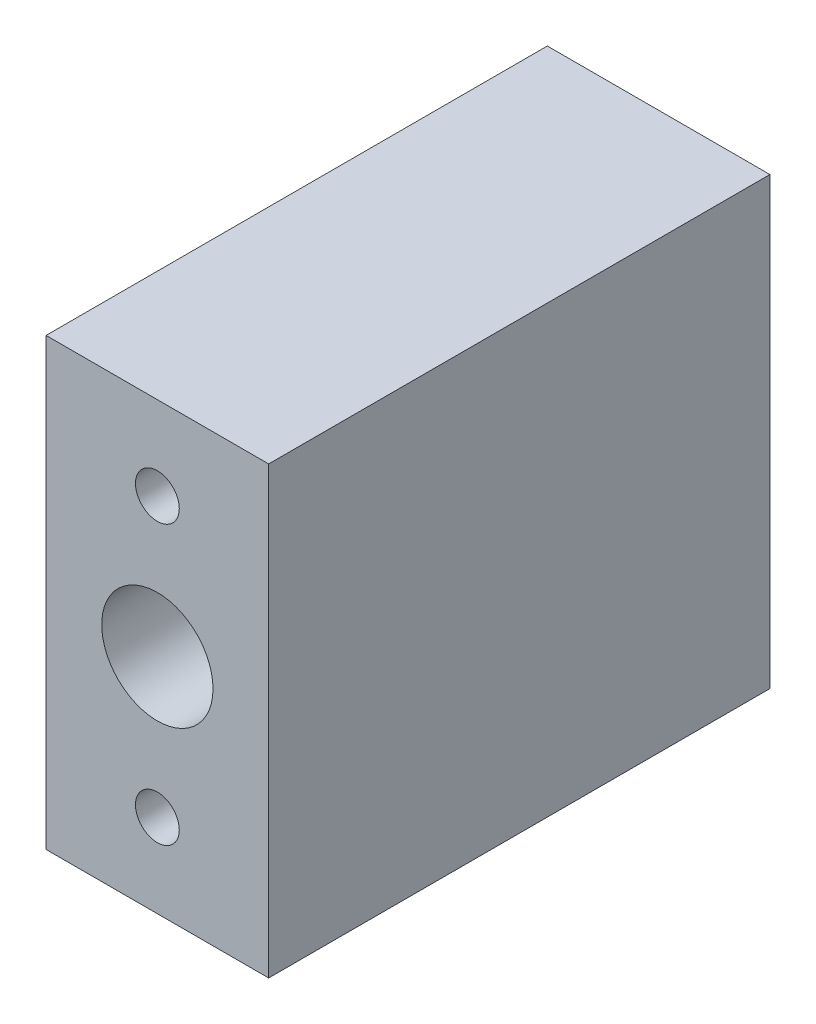
from build123d import *

# Parameters (mm, degrees)
SKETCH1_W           = 12.7
SKETCH1_H           = 28.5986
BOSS_EXTRUDE1_DEPTH = 25.4
SKETCH2_R           = 3.175
SKETCH2_R_2         = 1.25
CUT_EXTRUDE1_DEPTH  = 41.302976589


with BuildPart() as part:
    # Sketch1 → Boss-Extrude1 (new body)
    with BuildSketch(Plane(origin=(0, 0, 0), x_dir=(1, 0, 0), z_dir=(0, 1, 0))):
        with Locations((-6.35, 14.2993)):
            Rectangle(SKETCH1_W, SKETCH1_H)
    extrude(amount=BOSS_EXTRUDE1_DEPTH)

    # Sketch2 → Cut-Extrude1 (cut, through all)
    with BuildSketch(Plane.XY):
        with Locations((-6.35, 12.7)):
            Circle(SKETCH2_R)
        with Locations((-6.35, 20.6375)):
            Circle(SKETCH2_R_2)
        with Locations((-6.35, 4.7625)):
            Circle(SKETCH2_R_2)
    extrude(amount=-CUT_EXTRUDE1_DEPTH, mode=Mode.SUBTRACT)


solid = part.part
